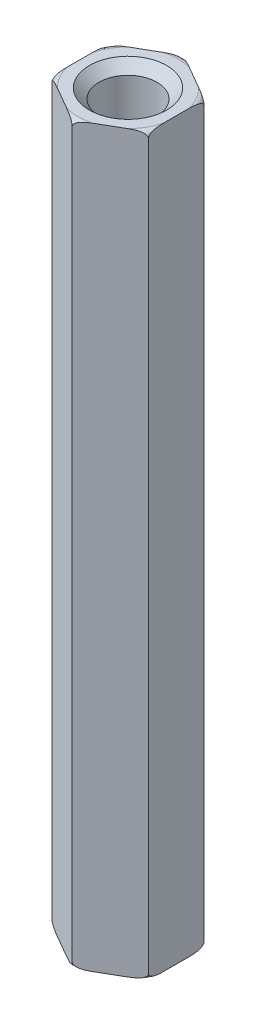
from build123d import *

# Parameters (mm, degrees)
SKETCH2_R           = 1.5
BOSS_EXTRUDE2_DEPTH = 19
CHAMFER1_SIZE       = 0.5


with BuildPart() as part:
    # Sketch2 → Boss-Extrude2 (new, symmetric)
    with BuildSketch(Plane(origin=(0, 0, 0), x_dir=(1, 0, 0), z_dir=(0, 1, 0))):
        Polygon((0, -2.886751346), (2.5, -1.443375673), (2.5, 1.443375673), (0, 2.886751346), (-2.5, 1.443375673), (-2.5, -1.443375673), align=None)
        with Locations(Location((0, 0, 0), (0, 0, 270))):
            Circle(SKETCH2_R, mode=Mode.SUBTRACT)
    extrude(amount=BOSS_EXTRUDE2_DEPTH, both=True)

    # Chamfer1
    chamfer1_edges = [part.edges().sort_by_distance(p)[0] for p in [
        (0, -19, -1.5),
        (0, 19, -1.5),
    ]]
    chamfer(chamfer1_edges, length=CHAMFER1_SIZE)

    # Sketch4 → Cut-Revolve1 (revolve, cut)
    with BuildSketch(Plane(origin=(0, 0, 0), x_dir=(0, 0, -1), z_dir=(1, 0, 0))):
        with BuildLine():
            Line((-2.886751346, 18.7), (-2.886751346, 19))
            Line((-2.886751346, 19), (-2.586751346, 19))
            ThreePointArc((-2.586751346, 19), (-2.79888338, 18.912132034), (-2.886751346, 18.7))
        make_face()
    cut_revolve1 = revolve(axis=Axis((0, 57.75, 0), (0, -1, 0)), mode=Mode.SUBTRACT)

    # Mirror1: Cut-Revolve1 across plane
    add(cut_revolve1.mirror(Plane.ZX), mode=Mode.SUBTRACT)


solid = part.part
